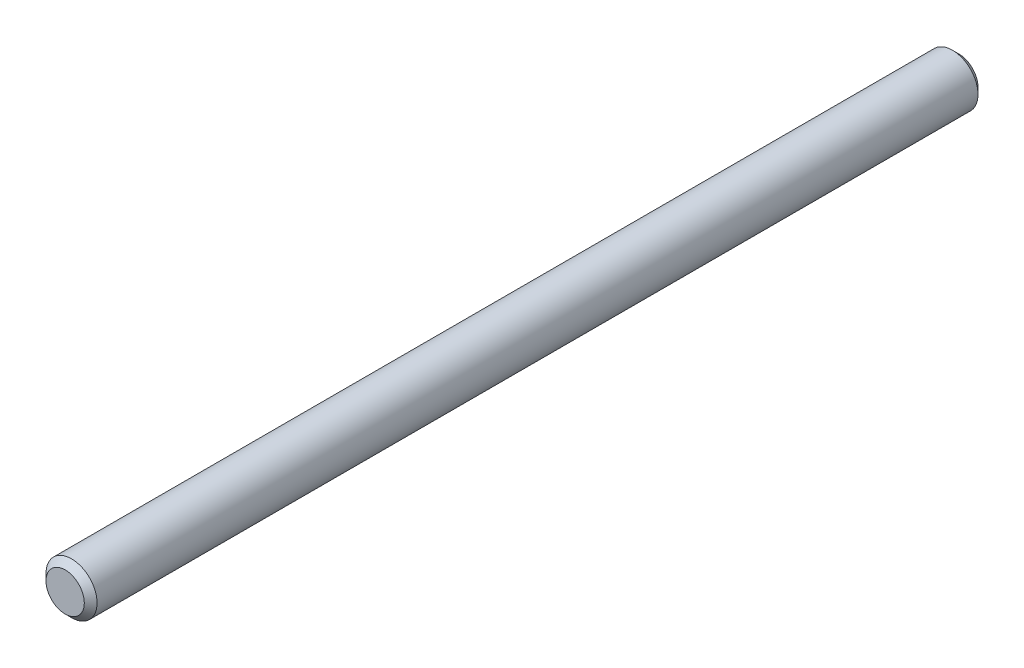
from build123d import *

# Parameters (mm, degrees)
SKETCH1_R           = 4
BOSS_EXTRUDE1_DEPTH = 140
CHAMFER1_SIZE       = 1


with BuildPart() as part:
    # Sketch1 → Boss-Extrude1 (new body)
    with BuildSketch(Plane.XY):
        Circle(SKETCH1_R)
    extrude(amount=BOSS_EXTRUDE1_DEPTH)

    # Chamfer1
    chamfer1_edges = [part.edges().sort_by_distance(p)[0] for p in [
        (-4, 0, 0),
        (-4, 0, 140),
    ]]
    chamfer(chamfer1_edges, length=CHAMFER1_SIZE)


solid = part.part
